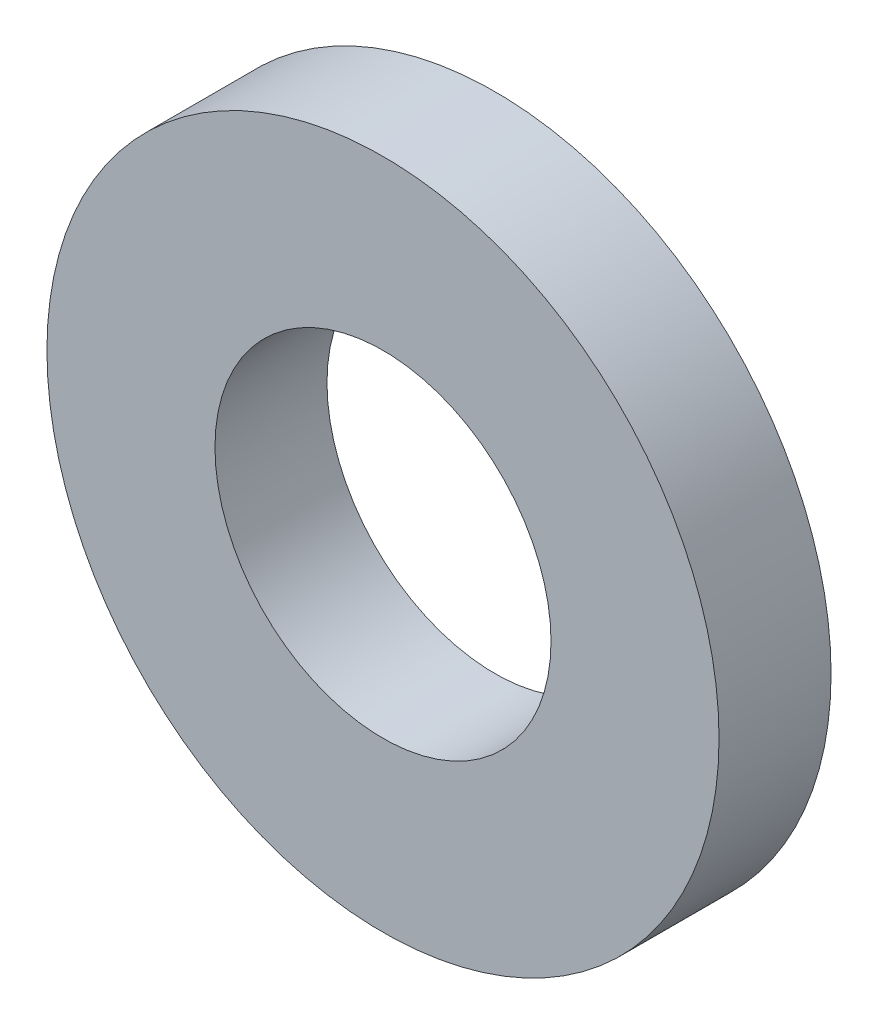
from build123d import *

# Parameters (mm, degrees)
SKETCH1_R           = 3
BOSS_EXTRUDE1_DEPTH = 1
SKETCH2_R           = 1.5
CUT_EXTRUDE1_DEPTH  = 1


with BuildPart() as part:
    # Sketch1 → Boss-Extrude1 (new body)
    with BuildSketch(Plane.XY):
        Circle(SKETCH1_R)
    extrude(amount=BOSS_EXTRUDE1_DEPTH)

    # Sketch2 → Cut-Extrude1 (cut)
    with BuildSketch(Plane(origin=(0, 0, 0), x_dir=(-1, 0, 0), z_dir=(0, 0, -1))):
        Circle(SKETCH2_R)
    extrude(amount=-CUT_EXTRUDE1_DEPTH, mode=Mode.SUBTRACT)


solid = part.part
